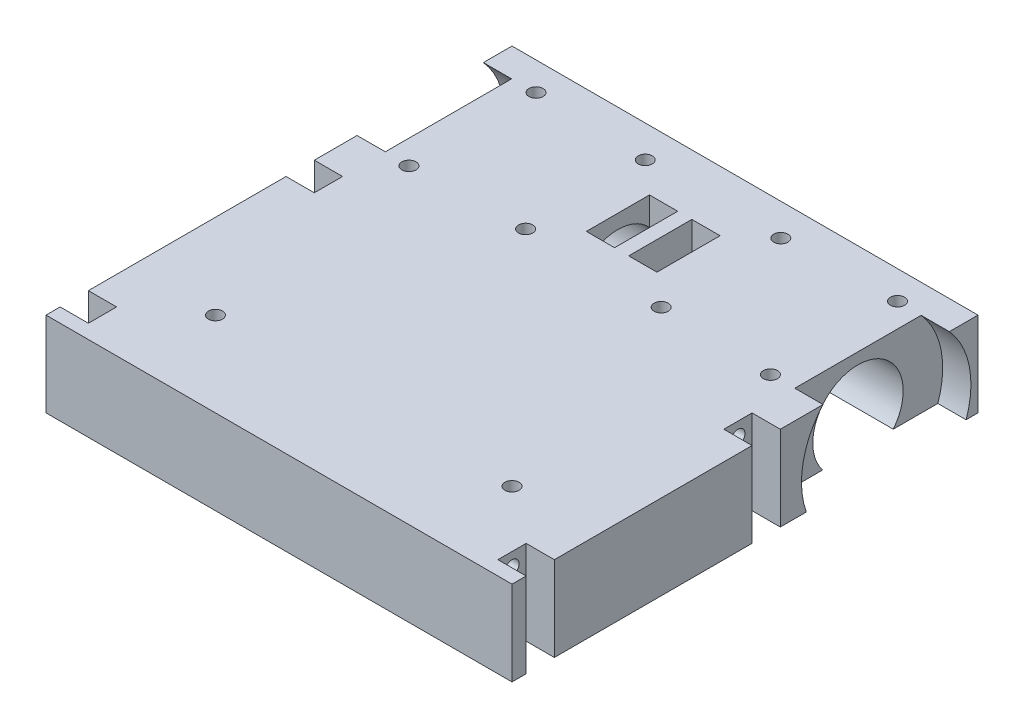
from build123d import *

# Parameters (mm, degrees)
ESQUISSE2_W                  = 165
ESQUISSE2_H                  = 165
BASE_DEPTH                   = 30
ESQUISSE3_R                  = 15
BLOC_MOTEUR_1_DEPTH          = 80
ESQUISSE4_W                  = 10
ESQUISSE4_H                  = 22.360679774
ACCES_MOTEUR_DEPTH           = 37
ESQUISSE6_R                  = 16.01
BLOC_MOTEUR_2_DEPTH          = 37
ESQUISSE7_R                  = 2.5
VIS_MOTEUR_DEPTH             = 121.467838032
ESQUISSE8_R                  = 2.5
VIS_PATIN_DEPTH              = 121.467838032
ESQUISSE12_R                 = 30
ESPACE_ROUE_DEPTH            = 10
ESQUISSE23_W                 = 10
ESQUISSE23_H                 = 30
VIDE_TIGE_DEPTH              = 10
VIDE_VIS_REACH               = 180.133
ESQUISSE25_R                 = 2.5
ENL_V_MAT_EXTRU_1_DEPTH      = 10
ENL_V_MAT_EXTRU_1_DEPTH_BACK = 10
BOSS_EXTRU_1_DEPTH           = 2.5
BOSS_EXTRU_1_DEPTH_BACK      = 2.5


with BuildPart() as part:
    # Esquisse2 → BASE (new body)
    with BuildSketch(Plane(origin=(0, 0, 0), x_dir=(1, 0, 0), z_dir=(0, 1, 0))):
        Rectangle(ESQUISSE2_W, ESQUISSE2_H)
    extrude(amount=BASE_DEPTH)

    # Esquisse3 → BLOC MOTEUR 1. (cut)
    with BuildSketch(Plane(origin=(82.5, 0, 0), x_dir=(0, 0, -1), z_dir=(1, 0, 0))):
        with Locations((50, 10)):
            Circle(ESQUISSE3_R)
    bloc_moteur_1 = extrude(amount=-BLOC_MOTEUR_1_DEPTH, mode=Mode.SUBTRACT)

    # Esquisse4 → ACCES MOTEUR (cut)
    with BuildSketch(Plane.XZ):
        with Locations((7.5, -50)):
            Rectangle(ESQUISSE4_W, ESQUISSE4_H)
    acces_moteur = extrude(amount=-ACCES_MOTEUR_DEPTH, mode=Mode.SUBTRACT)

    # Esquisse6 → BLOC MOTEUR 2 (cut)
    with BuildSketch(Plane(origin=(82.5, 0, 0), x_dir=(0, 0, -1), z_dir=(1, 0, 0))):
        with Locations((50, 10)):
            Circle(ESQUISSE6_R)
    bloc_moteur_2 = extrude(amount=-BLOC_MOTEUR_2_DEPTH, mode=Mode.SUBTRACT)

    # SYM BLOC MOTEUR: BLOC MOTEUR 1., ACCES MOTEUR, BLOC MOTEUR 2 across plane
    add(bloc_moteur_1.mirror(Plane(origin=(0, 0, 0), x_dir=(0, 0, 1), z_dir=(1, 0, 0))), mode=Mode.SUBTRACT)
    add(acces_moteur.mirror(Plane(origin=(0, 0, 0), x_dir=(0, 0, 1), z_dir=(1, 0, 0))), mode=Mode.SUBTRACT)
    add(bloc_moteur_2.mirror(Plane(origin=(0, 0, 0), x_dir=(0, 0, 1), z_dir=(1, 0, 0))), mode=Mode.SUBTRACT)

    # Esquisse7 → VIS MOTEUR (cut, through all)
    with BuildSketch(Plane.XZ):
        with Locations(Location((-64, -27.497196314, 0), (0, 0, 270))):
            Circle(ESQUISSE7_R)
        with Locations(Location((-24, -28.819660113, 0), (0, 0, 270))):
            Circle(ESQUISSE7_R)
        with Locations(Location((-24, -71.180339887, 0), (0, 0, 270))):
            Circle(ESQUISSE7_R)
        with Locations(Location((-64, -72.502803686, 0), (0, 0, 270))):
            Circle(ESQUISSE7_R)
    vis_moteur = extrude(amount=-VIS_MOTEUR_DEPTH, mode=Mode.SUBTRACT)

    # SYM VIS: VIS MOTEUR across plane
    add(vis_moteur.mirror(Plane(origin=(0, 0, 0), x_dir=(0, 0, 1), z_dir=(1, 0, 0))), mode=Mode.SUBTRACT)

    # Esquisse8 → VIS PATIN (cut, through all)
    with BuildSketch(Plane.XZ):
        with Locations(Location((-52.5, 52.5, 0), (0, 0, 270))):
            Circle(ESQUISSE8_R)
        with Locations(Location((52.5, 52.5, 0), (0, 0, 270))):
            Circle(ESQUISSE8_R)
    extrude(amount=-VIS_PATIN_DEPTH, mode=Mode.SUBTRACT)

    # Esquisse12 → ESPACE ROUE (cut)
    with BuildSketch(Plane.ZY.offset(82.5)):
        with Locations((-50, 10)):
            Circle(ESQUISSE12_R)
    espace_roue = extrude(amount=-ESPACE_ROUE_DEPTH, mode=Mode.SUBTRACT)

    # SYM ESPACE ROUE: ESPACE ROUE across plane
    add(espace_roue.mirror(Plane(origin=(0, 0, 0), x_dir=(0, 0, 1), z_dir=(1, 0, 0))), mode=Mode.SUBTRACT)

    # Esquisse23 → VIDE TIGE (cut)
    with BuildSketch(Plane(origin=(82.5, 0, 0), x_dir=(0, 0, -1), z_dir=(1, 0, 0))):
        with Locations((-72.5, 15)):
            Rectangle(ESQUISSE23_W, ESQUISSE23_H)
        with Locations((7.5, 15)):
            Rectangle(ESQUISSE23_W, ESQUISSE23_H)
    vide_tige = extrude(amount=-VIDE_TIGE_DEPTH, mode=Mode.SUBTRACT)

    # SYM TIGE: VIDE TIGE across plane
    add(vide_tige.mirror(Plane(origin=(0, 0, 0), x_dir=(0, 0, 1), z_dir=(1, 0, 0))), mode=Mode.SUBTRACT)

    # Esquisse25 → VIDE VIS (cut, up to next)
    with BuildSketch(Plane(origin=(72.5, 0, 0), x_dir=(0, 0, -1), z_dir=(1, 0, 0)), mode=Mode.PRIVATE) as vide_vis_sk1:
        with Locations((-72.5, 25)):
            Circle(ESQUISSE25_R)
    vide_vis_tool1 = extrude(vide_vis_sk1.sketch, amount=-VIDE_VIS_REACH, mode=Mode.PRIVATE) & part.part
    # Esquisse25 → VIDE VIS (cut, up to next)
    with BuildSketch(Plane(origin=(72.5, 0, 0), x_dir=(0, 0, -1), z_dir=(1, 0, 0)), mode=Mode.PRIVATE) as vide_vis_sk2:
        with Locations((-72.5, 15)):
            Circle(ESQUISSE25_R)
    vide_vis_tool2 = extrude(vide_vis_sk2.sketch, amount=-VIDE_VIS_REACH, mode=Mode.PRIVATE) & part.part
    # Esquisse25 → VIDE VIS (cut, up to next)
    with BuildSketch(Plane(origin=(72.5, 0, 0), x_dir=(0, 0, -1), z_dir=(1, 0, 0)), mode=Mode.PRIVATE) as vide_vis_sk3:
        with Locations((-72.5, 5)):
            Circle(ESQUISSE25_R)
    vide_vis_tool3 = extrude(vide_vis_sk3.sketch, amount=-VIDE_VIS_REACH, mode=Mode.PRIVATE) & part.part
    # Esquisse25 → VIDE VIS (cut, up to next)
    with BuildSketch(Plane(origin=(72.5, 0, 0), x_dir=(0, 0, -1), z_dir=(1, 0, 0)), mode=Mode.PRIVATE) as vide_vis_sk4:
        with Locations(Location((7.5, 5, 0), (0, 0, 180))):
            Circle(ESQUISSE25_R)
    vide_vis_tool4 = extrude(vide_vis_sk4.sketch, amount=-VIDE_VIS_REACH, mode=Mode.PRIVATE) & part.part
    # Esquisse25 → VIDE VIS (cut, up to next)
    with BuildSketch(Plane(origin=(72.5, 0, 0), x_dir=(0, 0, -1), z_dir=(1, 0, 0)), mode=Mode.PRIVATE) as vide_vis_sk5:
        with Locations(Location((7.5, 25, 0), (0, 0, 180))):
            Circle(ESQUISSE25_R)
    vide_vis_tool5 = extrude(vide_vis_sk5.sketch, amount=-VIDE_VIS_REACH, mode=Mode.PRIVATE) & part.part
    # Esquisse25 → VIDE VIS (cut, up to next)
    with BuildSketch(Plane(origin=(72.5, 0, 0), x_dir=(0, 0, -1), z_dir=(1, 0, 0)), mode=Mode.PRIVATE) as vide_vis_sk6:
        with Locations(Location((7.5, 15, 0), (0, 0, 180))):
            Circle(ESQUISSE25_R)
    vide_vis_tool6 = extrude(vide_vis_sk6.sketch, amount=-VIDE_VIS_REACH, mode=Mode.PRIVATE) & part.part
    add(vide_vis_tool1.solids().sort_by_distance((72.5, 25, 72.5))[0], mode=Mode.SUBTRACT)
    add(vide_vis_tool2.solids().sort_by_distance((72.5, 15, 72.5))[0], mode=Mode.SUBTRACT)
    add(vide_vis_tool3.solids().sort_by_distance((72.5, 5, 72.5))[0], mode=Mode.SUBTRACT)
    add(vide_vis_tool4.solids().sort_by_distance((72.5, 5, -7.5))[0], mode=Mode.SUBTRACT)
    add(vide_vis_tool5.solids().sort_by_distance((72.5, 25, -7.5))[0], mode=Mode.SUBTRACT)
    add(vide_vis_tool6.solids().sort_by_distance((72.5, 15, -7.5))[0], mode=Mode.SUBTRACT)

    # Esquisse27 → Enlèv. mat.-Extru.1 (cut, two sides: drawn at the far end of the back side and taken through both)
    with BuildSketch(Plane(origin=(0, 15, 0), x_dir=(1, 0, 0), z_dir=(0, 1, 0)).offset(-ENL_V_MAT_EXTRU_1_DEPTH_BACK)):
        Polygon((-77.5, -62.5), (-77.5, -2.5), (-68.5, -2.5), (-68.5, 16.142194012), (-68.5, 33.497196314), (-45.5, 33.497196314), (-45.5, 34.819660113), (45.5, 34.819660113), (45.5, 33.497196314), (68.5, 33.497196314), (68.5, 16.142194012), (68.5, -2.5), (77.5, -2.5), (77.5, -62.5), (67.5, -62.5), (67.5, -77.5), (-67.5, -77.5), (-67.5, -62.5), align=None)
        Polygon((-68.5, 66.502803686), (-45.5, 66.502803686), (-45.5, 65.180339887), (45.5, 65.180339887), (45.5, 66.502803686), (68.5, 66.502803686), (68.5, 77.5), (-68.5, 77.5), align=None)
    extrude(amount=ENL_V_MAT_EXTRU_1_DEPTH + ENL_V_MAT_EXTRU_1_DEPTH_BACK, mode=Mode.SUBTRACT)

    # Esquisse29 → Boss.-Extru.1 (add, two sides: drawn at the far end of the back side and taken through both)
    with BuildSketch(Plane(origin=(0, 15, 0), x_dir=(1, 0, 0), z_dir=(0, 1, 0)).offset(-BOSS_EXTRU_1_DEPTH_BACK)):
        with BuildLine():
            Line((-76.098768454, 2.5), (0, -29.784326011))
            Line((0, -29.784326011), (76.098768454, 2.5))
            Line((76.098768454, 2.5), (82.5, 2.5))
            Line((82.5, 2.5), (82.5, -0.215673989))
            Line((82.5, -0.215673989), (6.401231546, -32.5))
            Line((6.401231546, -32.5), (50.38861991, -51.161316275))
            ThreePointArc((50.38861991, -51.161316275), (51.523625383, -54.801454455), (54.929888079, -53.087914893))
            Line((54.929888079, -53.087914893), (82.5, -64.784326011))
            Line((82.5, -64.784326011), (82.5, -67.5))
            Line((82.5, -67.5), (76.098768454, -67.5))
            Line((76.098768454, -67.5), (0, -35.215673989))
            Line((0, -35.215673989), (-76.098768454, -67.5))
            Line((-76.098768454, -67.5), (-82.5, -67.5))
            Line((-82.5, -67.5), (-82.5, -64.784326011))
            Line((-82.5, -64.784326011), (-54.929888079, -53.087914893))
            ThreePointArc((-54.929888079, -53.087914893), (-51.523625383, -54.801454455), (-50.38861991, -51.161316275))
            Line((-50.38861991, -51.161316275), (-6.401231546, -32.5))
            Line((-6.401231546, -32.5), (-82.5, -0.215673989))
            Line((-82.5, -0.215673989), (-82.5, 2.5))
            Line((-82.5, 2.5), (-76.098768454, 2.5))
        make_face()
    extrude(amount=BOSS_EXTRU_1_DEPTH + BOSS_EXTRU_1_DEPTH_BACK)


solid = part.part
